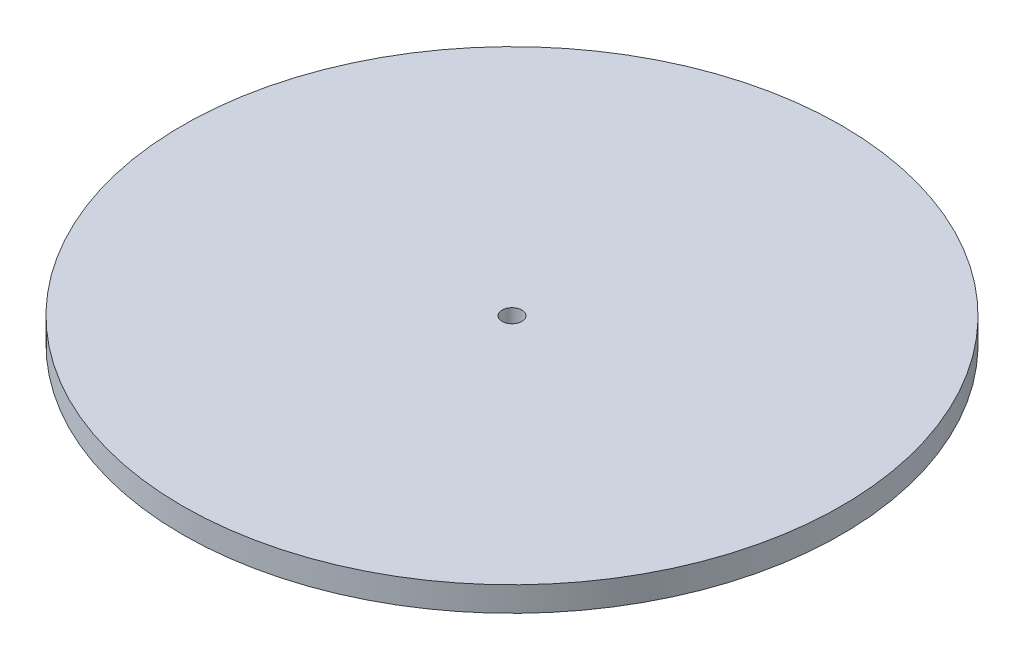
from build123d import *

# Parameters (mm, degrees)
SKETCH5_R          = 1.2
CUT_EXTRUDE1_DEPTH = 58.93530025


with BuildPart() as part:
    # Sketch3 → Revolve4 (revolve)
    with BuildSketch(Plane.XY, mode=Mode.PRIVATE) as revolve4_sk:
        with BuildLine():
            Line((1.2, 12.509956537), (1.2, 7.509956537))
            Line((1.2, 7.509956537), (0, 7.509956537))
            Line((0, 7.509956537), (0, 0))
            add(Edge.make_bspline(
                [(0, 0), (4.625000004, 0.00115105), (9.250000006, 0.507761818), (13.875000006, 1.561460586), (18.500000006, 2.812680954), (23.125000005, 4.177703823), (27.750000003, 5.607570275), (32.375000002, 7.055984932), (37, 8.509956537)],
                knots=[0.083462492, 0.083462492, 0.083462492, 0.083462492, 0.083462492, 0.083462492, 0.083462492, 0.083462492, 0.083462492, 0.918087416, 0.918087416, 0.918087416, 0.918087416, 0.918087416, 0.918087416, 0.918087416, 0.918087416, 0.918087416], degree=8))
            Line((37, 8.509956537), (37, 9.509956537))
            Line((37, 9.509956537), (40, 9.509956537))
            Line((40, 9.509956537), (40, 12.509956537))
            Line((40, 12.509956537), (1.2, 12.509956537))
        make_face()
    revolve(revolve4_sk.sketch.rotate(Axis((0, 12.509956537, 0), (0, -1, 0)), 90), axis=Axis((0, 12.509956537, 0), (0, -1, 0)))

    # Sketch5 → Cut-Extrude1 (cut, through all)
    with BuildSketch(Plane(origin=(0, 12.509956537, 0), x_dir=(1, 0, 0), z_dir=(0, 1, 0))):
        with Locations(Location((0, 0, 0), (0, 0, 270))):
            Circle(SKETCH5_R)
    extrude(amount=-CUT_EXTRUDE1_DEPTH, mode=Mode.SUBTRACT)


solid = part.part
